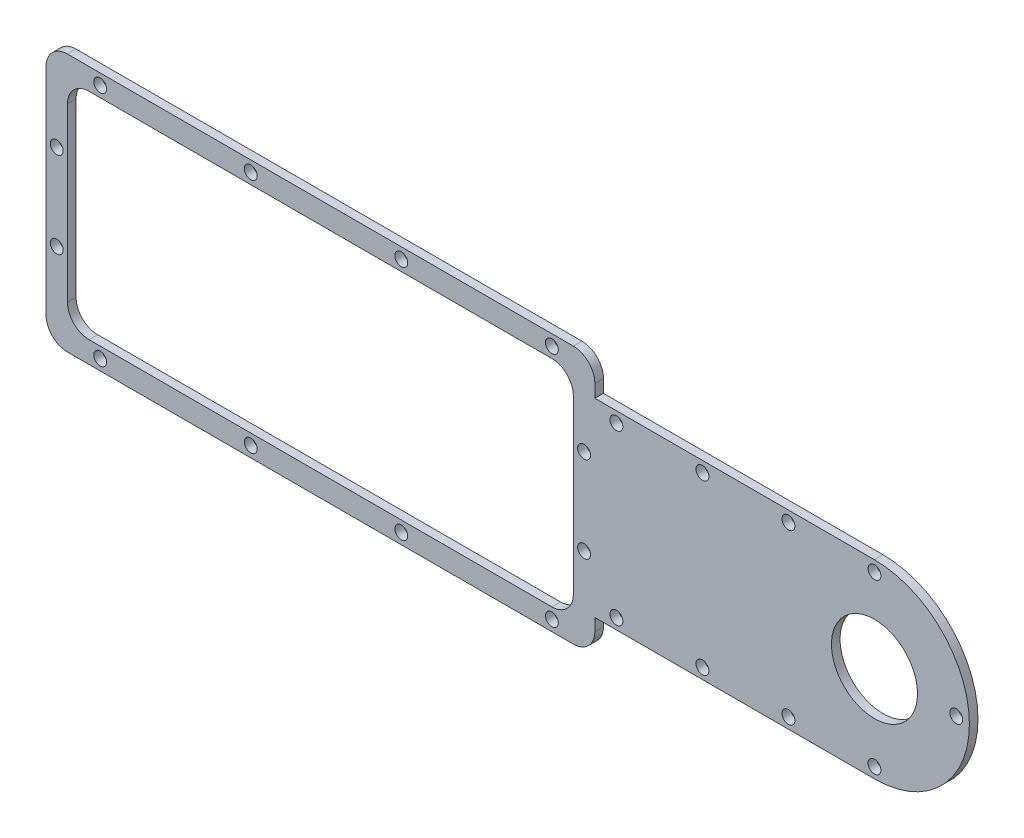
from build123d import *

# Parameters (mm, degrees)
SKETCH1_R           = 10
BOSS_EXTRUDE1_DEPTH = 2
CUT_EXTRUDE1_DEPTH  = 5
FILLET1_R           = 5
SKETCH3_R           = 1.5
CUT_EXTRUDE2_DEPTH  = 5
SKETCH4_R           = 1.5
CUT_EXTRUDE3_DEPTH  = 154.844633691


with BuildPart() as part:
    # Sketch1 → Boss-Extrude1 (new body)
    # profile 1 of 2: a face of its own
    with BuildSketch(Plane.XY):
        with BuildLine():
            Line((128.81, 22), (63.8, 22))
            Line((63.8, 22), (63.8, -22.13600286))
            Line((63.8, -22.13600286), (128.81, -22.13600286))
            ThreePointArc((128.81, -22.13600286), (150.87800143, -0.06800143), (128.81, 22))
        make_face()
        with Locations((128.81, 0)):
            Circle(SKETCH1_R, mode=Mode.SUBTRACT)
    # profile 2 of 2: a face of its own
    with BuildSketch(Plane.XY):
        with BuildLine():
            Line((-58.8, 30), (58.8, 30))
            ThreePointArc((58.8, 30), (62.335533906, 28.535533906), (63.8, 25))
            Line((63.8, 25), (63.8, -25))
            ThreePointArc((63.8, -25), (62.335533906, -28.535533906), (58.8, -30))
            Line((58.8, -30), (-58.8, -30))
            ThreePointArc((-58.8, -30), (-62.335533906, -28.535533906), (-63.8, -25))
            Line((-63.8, -25), (-63.8, 25))
            ThreePointArc((-63.8, 25), (-62.335533906, 28.535533906), (-58.8, 30))
        make_face()
    extrude(amount=BOSS_EXTRUDE1_DEPTH)

    # Sketch2 → Cut-Extrude1 (cut)
    with BuildSketch(Plane.XY.offset(2)):
        Polygon((58.8, 17), (58.8, -17.13600286), (58.8, -25), (-58.8, -25), (-58.8, 25), (58.8, 25), align=None)
    extrude(amount=-CUT_EXTRUDE1_DEPTH, mode=Mode.SUBTRACT)

    # Fillet1
    fillet1_edges = [part.edges().sort_by_distance(p)[0] for p in [
        (58.8, -25, 1),
        (-58.8, -25, 1),
        (-58.8, 25, 1),
        (58.8, 25, 1),
    ]]
    fillet(fillet1_edges, radius=FILLET1_R)

    # Sketch3 → Cut-Extrude2 (cut)
    with BuildSketch(Plane.XY.offset(2)):
        with Locations((-51.2, 27.5)):
            Circle(SKETCH3_R)
        with Locations((-16.2, 27.5)):
            Circle(SKETCH3_R)
        with Locations((18.8, 27.5)):
            Circle(SKETCH3_R)
        with Locations((53.8, 27.5)):
            Circle(SKETCH3_R)
        with Locations((61.3, 10)):
            Circle(SKETCH3_R)
        with Locations((61.3, -10)):
            Circle(SKETCH3_R)
        with Locations((53.8, -27.5)):
            Circle(SKETCH3_R)
        with Locations((18.8, -27.5)):
            Circle(SKETCH3_R)
        with Locations((-16.2, -27.5)):
            Circle(SKETCH3_R)
        with Locations((-51.2, -27.5)):
            Circle(SKETCH3_R)
        with Locations((-61.3, -10)):
            Circle(SKETCH3_R)
        with Locations((-61.3, 10)):
            Circle(SKETCH3_R)
    extrude(amount=-CUT_EXTRUDE2_DEPTH, mode=Mode.SUBTRACT)

    # Sketch4 → Cut-Extrude3 (cut, through all)
    with BuildSketch(Plane.XY.offset(2)):
        with Locations((68.81, 19.5)):
            Circle(SKETCH4_R)
        with Locations((88.81, 19.5)):
            Circle(SKETCH4_R)
        with Locations((108.81, 19.5)):
            Circle(SKETCH4_R)
        with Locations((128.81, 19.5)):
            Circle(SKETCH4_R)
        with Locations((88.81, -19.66)):
            Circle(SKETCH4_R)
        with Locations((108.81, -19.66)):
            Circle(SKETCH4_R)
        with Locations((128.81, -19.66)):
            Circle(SKETCH4_R)
        with Locations((68.81, -19.66)):
            Circle(SKETCH4_R)
        with Locations((147.81, 0)):
            Circle(SKETCH4_R)
    extrude(amount=-CUT_EXTRUDE3_DEPTH, mode=Mode.SUBTRACT)


solid = part.part
